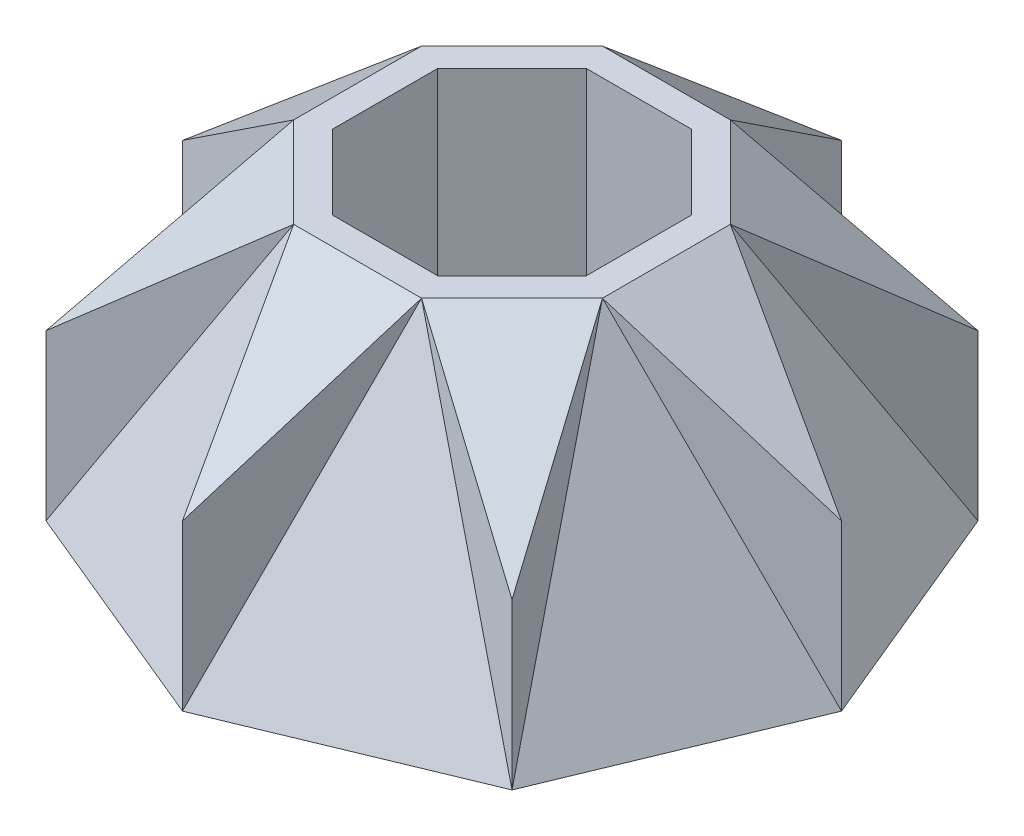
from build123d import *

# Parameters (mm, degrees)
EXTRUDE_1_DEPTH          = 55
CUT_EXTRUDE_3_DEPTH      = 323.664416923
PATTERN_CIRCULAR_1_COUNT = 8
CUT_EXTRUDE_4_DEPTH      = 158.777475037
PATTERN_CIRCULAR_2_COUNT = 8


with BuildPart() as part:
    # 草图1 → 凸台-拉伸1 (new body)
    with BuildSketch(Plane(origin=(0, 0, 0), x_dir=(1, 0, 0), z_dir=(0, 1, 0))):
        Polygon((42.426406871, -42.426406871), (60, 0), (42.426406871, 42.426406871), (0, 60), (-42.426406871, 42.426406871), (-60, 0), (-42.426406871, -42.426406871), (0, -60), align=None)
        Polygon((23.111992498, -9.573300746), (23.111992498, 9.573300746), (9.573300746, 23.111992498), (-9.573300746, 23.111992498), (-23.111992498, 9.573300746), (-23.111992498, -9.573300746), (-9.573300746, -23.111992498), (9.573300746, -23.111992498), align=None, mode=Mode.SUBTRACT)
    extrude(amount=EXTRUDE_1_DEPTH)

    # 草图4 → 切除-拉伸3 (cut, through all, along a direction that is not the sketch's normal)
    with BuildSketch(Plane(origin=(-17.57970482, 20.884718614, 42.441161798), x_dir=(0.9373566365157255, 0.153814342715155, 0.31257588511436873), z_dir=(-0.34837126170211885, 0.4138656392921341, 0.8410426247422821))):
        Polygon((6.331993641, 36.93658877), (-26.507202364, -18.732285364), (18.754553107, -26.491452015), align=None)
    cut_extrude_3 = extrude(amount=CUT_EXTRUDE_3_DEPTH, dir=(0, 1, 0), mode=Mode.SUBTRACT)

    # 阵列(圆周)1: 切除-拉伸3 ×8 about axis
    pattern_circular_1_axis = Axis((0, 55, 0), (0, -1, 0))
    for i in range(1, PATTERN_CIRCULAR_1_COUNT):
        add(cut_extrude_3.rotate(pattern_circular_1_axis, i * 360 / PATTERN_CIRCULAR_1_COUNT), mode=Mode.SUBTRACT)

    # 草图8 → 切除-拉伸4 (cut, through all, along a direction that is not the sketch's normal)
    with BuildSketch(Plane(origin=(-37.406700868, 47.713006316, 0), x_dir=(-0.7869756649359425, -0.616984037717858, 0), z_dir=(0.616984037717858, -0.7869756649359426, 0))):
        Polygon((-11.810668086, 11.644368558), (-11.810668086, -11.644368558), (28.709826154, 0), align=None)
    cut_extrude_4 = extrude(amount=-CUT_EXTRUDE_4_DEPTH, dir=(0, -1, 0), mode=Mode.SUBTRACT)

    # 阵列(圆周)2: 切除-拉伸4 ×8 about axis
    pattern_circular_2_axis = Axis((0, 55, 0), (0, -1, 0))
    for i in range(1, PATTERN_CIRCULAR_2_COUNT):
        add(cut_extrude_4.rotate(pattern_circular_2_axis, i * 360 / PATTERN_CIRCULAR_2_COUNT), mode=Mode.SUBTRACT)


solid = part.part
